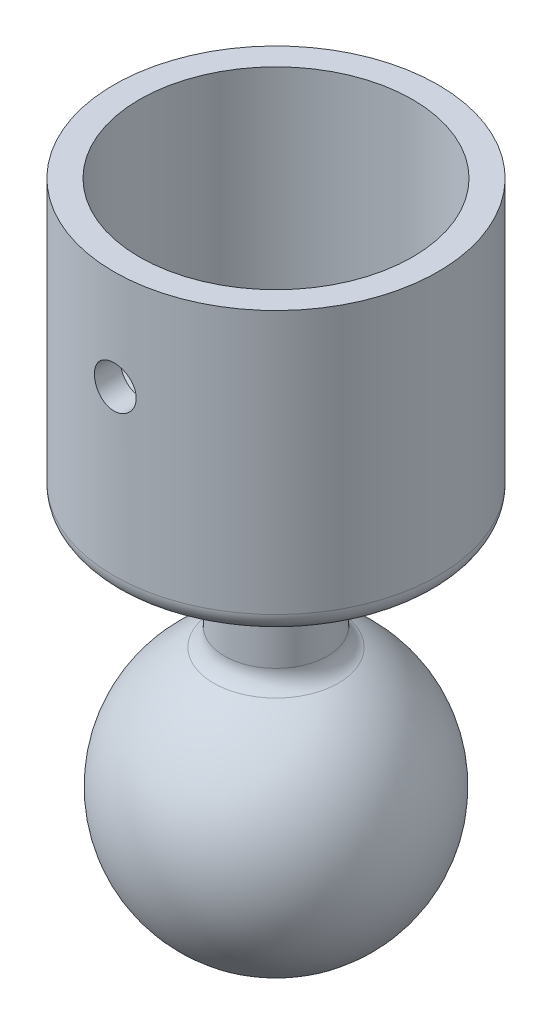
from build123d import *

# Parameters (mm, degrees)
SKETCH2_R           = 6.35
BOSS_EXTRUDE1_DEPTH = 30
SKETCH3_R           = 20
BOSS_EXTRUDE3_DEPTH = 10
FILLET1_R           = 3.9
SKETCH4_R           = 20
SKETCH4_R_2         = 16.85
BOSS_EXTRUDE4_DEPTH = 25
FILLET2_R           = 2.5
FILLET3_R           = 2.5
SKETCH5_R           = 2.5796875
CUT_EXTRUDE1_DEPTH  = 71.887234394


with BuildPart() as part:
    # Sketch1 → Revolve3 (revolve)
    with BuildSketch(Plane(origin=(0, 0, 0), x_dir=(1, 0, 0), z_dir=(0, 1, 0))):
        with BuildLine():
            Line((0, 16.75), (0, -16.75))
            ThreePointArc((0, -16.75), (16.75, 0), (0, 16.75))
        make_face()
    revolve(axis=Axis((0, 0, -16.75), (0, 0, 1)))

    # Sketch2 → Boss-Extrude1 (add)
    with BuildSketch(Plane(origin=(0, 0, 0), x_dir=(1, 0, 0), z_dir=(0, 1, 0))):
        with Locations(Location((0, 0, 0), (0, 0, 90))):
            Circle(SKETCH2_R)
    extrude(amount=BOSS_EXTRUDE1_DEPTH)

    # Sketch3 → Boss-Extrude3 (add)
    with BuildSketch(Plane(origin=(0, 30, 0), x_dir=(1, 0, 0), z_dir=(0, 1, 0))):
        with Locations(Location((0, 0, 0), (0, 0, 270))):
            Circle(SKETCH3_R)
    extrude(amount=BOSS_EXTRUDE3_DEPTH)

    # Fillet1
    fillet1_edges = [part.edges().sort_by_distance(p)[0] for p in [
        (0, 30, 6.35),
    ]]
    fillet(fillet1_edges, radius=FILLET1_R)

    # Sketch4 → Boss-Extrude4 (add)
    with BuildSketch(Plane(origin=(0, 40, 0), x_dir=(1, 0, 0), z_dir=(0, 1, 0))):
        with Locations(Location((0, 0, 0), (0, 0, 270))):
            Circle(SKETCH4_R)
        with Locations(Location((0, 0, 0), (0, 0, 270))):
            Circle(SKETCH4_R_2, mode=Mode.SUBTRACT)
    extrude(amount=BOSS_EXTRUDE4_DEPTH)

    # Fillet2
    fillet2_edges = [part.edges().sort_by_distance(p)[0] for p in [
        (0, 30, -20),
    ]]
    fillet(fillet2_edges, radius=FILLET2_R)

    # Fillet3
    fillet3_edges = [part.edges().sort_by_distance(p)[0] for p in [
        (0, 15.499677416, 6.35),
    ]]
    fillet(fillet3_edges, radius=FILLET3_R)

    # Sketch5 → Cut-Extrude1 (cut, through all)
    with BuildSketch(Plane.XY):
        with Locations(Location((0, 52.7, 0), (0, 0, 90.000000055))):
            Circle(SKETCH5_R)
    extrude(amount=CUT_EXTRUDE1_DEPTH, mode=Mode.SUBTRACT)


solid = part.part
